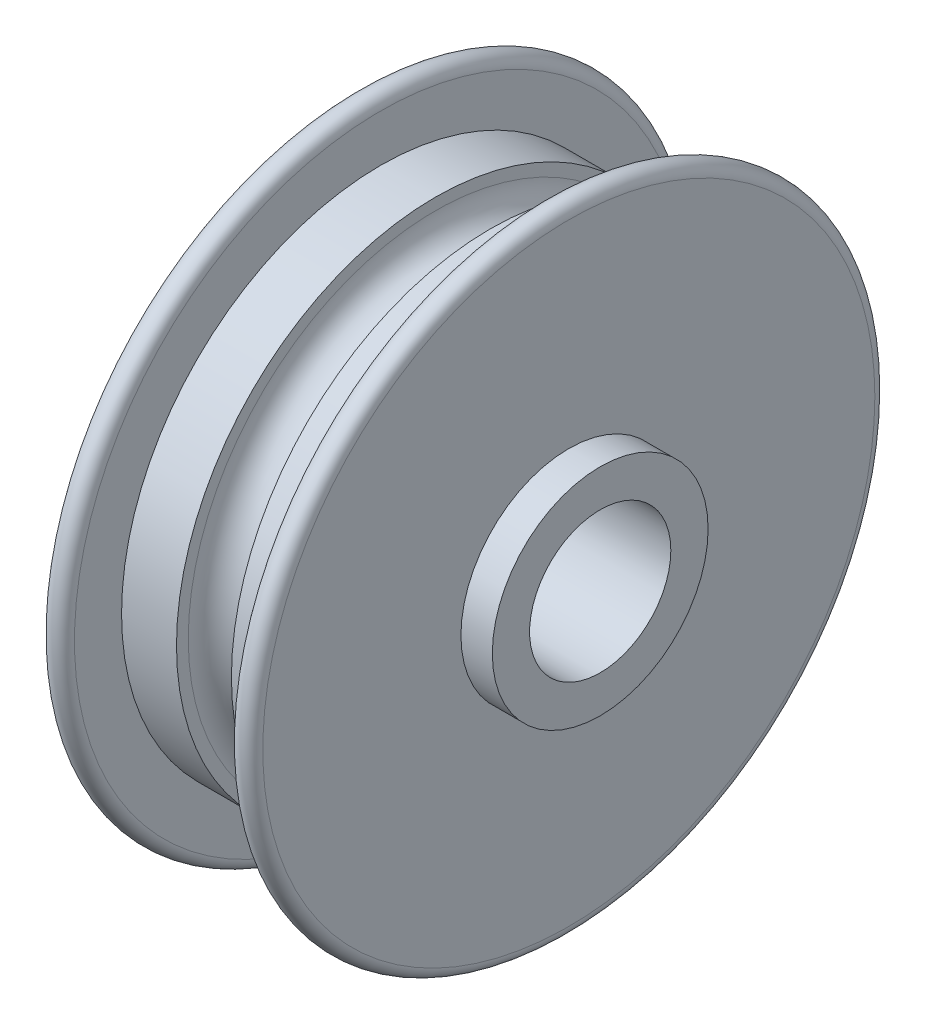
from build123d import *


with BuildPart() as part:
    # Sketch1 → Revolve1 (revolve)
    with BuildSketch(Plane.XY, mode=Mode.PRIVATE) as revolve1_sk:
        with BuildLine():
            Line((26.175913368, 13.75), (26.175913368, 9))
            Line((26.175913368, 9), (-8.824086632, 9))
            Line((-8.824086632, 9), (-8.824086632, 13.75))
            Line((-8.824086632, 13.75), (-4.824086632, 13.75))
            Line((-4.824086632, 13.75), (-4.824086632, 39))
            ThreePointArc((-4.824086632, 39), (-3.324086632, 40.5), (-1.824086632, 39))
            Line((-1.824086632, 39), (-1.824086632, 33))
            Line((-1.824086632, 33), (5.175913368, 33))
            Line((5.175913368, 33), (5.175913368, 31.5))
            ThreePointArc((5.175913368, 31.5), (8.675913368, 28), (12.175913368, 31.5))
            Line((12.175913368, 31.5), (12.175913368, 33))
            Line((12.175913368, 33), (19.175913368, 33))
            Line((19.175913368, 33), (19.175913368, 39))
            ThreePointArc((19.175913368, 39), (20.675913368, 40.5), (22.175913368, 39))
            Line((22.175913368, 39), (22.175913368, 13.75))
            Line((22.175913368, 13.75), (26.175913368, 13.75))
        make_face()
    revolve(revolve1_sk.sketch.rotate(Axis((-24.461552005, 0, 0), (1, 0, 0)), 270), axis=Axis((-24.461552005, 0, 0), (1, 0, 0)))


solid = part.part
